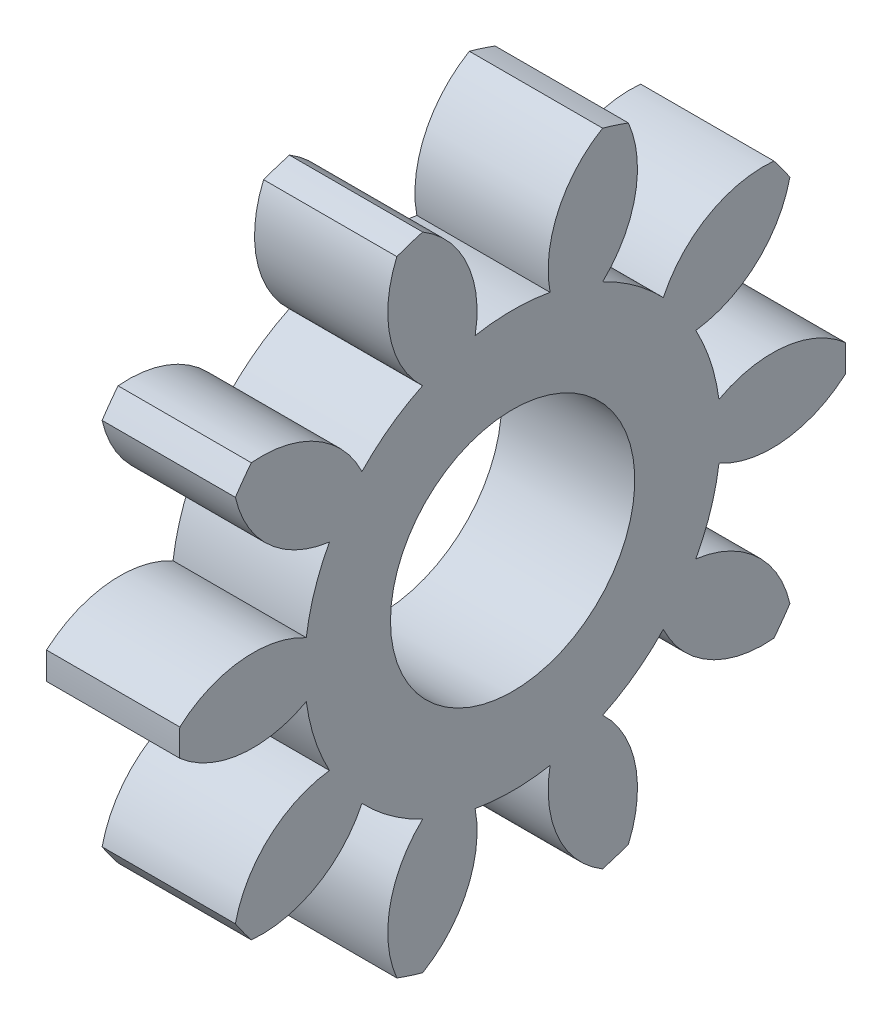
from build123d import *

# Parameters (mm, degrees)
BASPROSKE_W     = 12
BASPROSKE_H     = 30
TOOTHCUT_DEPTH  = 45.09081537
TEETHCUTS_COUNT = 10
TEETHCUTS_ANGLE = 324
BORSKE_R        = 11
BORE_DEPTH      = 50.0000508


with BuildPart() as part:
    # BasProSke → Base-Revolve (revolve)
    with BuildSketch(Plane(origin=(0, 0, 0), x_dir=(1, 0, 0), z_dir=(0, 1, 0)), mode=Mode.PRIVATE) as base_revolve_sk:
        with Locations((6, 15)):
            Rectangle(BASPROSKE_W, BASPROSKE_H)
    revolve(base_revolve_sk.sketch.rotate(Axis((-10, 0, 0), (1, 0, 0)), 180), axis=Axis((-10, 0, 0), (1, 0, 0)))

    # TooCutSke → ToothCut (cut, through all)
    with BuildSketch(Plane(origin=(0, 0, 0), x_dir=(0, 0, -1), z_dir=(1, 0, 0))):
        with BuildLine():
            ThreePointArc((3.373955922, 18.44292337), (0, 18.749), (-3.373955922, 18.44292337))
            ThreePointArc((-3.373955922, 18.44292337), (-4.099522353, 24.424717538), (-8.130302123, 28.903681989))
            ThreePointArc((-8.130302123, 28.903681989), (0, 30.0254), (8.130302123, 28.903681989))
            ThreePointArc((8.130302123, 28.903681989), (4.099522353, 24.424717538), (3.373955922, 18.44292337))
        make_face()
    toothcut = extrude(amount=TOOTHCUT_DEPTH, mode=Mode.SUBTRACT)

    # TeethCuts: ToothCut ×10 about axis
    teethcuts_axis = Axis((-10, 0, 0), (1, 0, 0))
    for i in range(1, TEETHCUTS_COUNT):
        add(toothcut.rotate(teethcuts_axis, i * TEETHCUTS_ANGLE / (TEETHCUTS_COUNT - 1)), mode=Mode.SUBTRACT)

    # BorSke → Bore (cut, symmetric)
    with BuildSketch(Plane(origin=(0, 0, 0), x_dir=(0, 0, -1), z_dir=(1, 0, 0))):
        with Locations(Location((0, 0, 0), (0, 0, 180))):
            Circle(BORSKE_R)
    extrude(amount=BORE_DEPTH, both=True, mode=Mode.SUBTRACT)


solid = part.part
